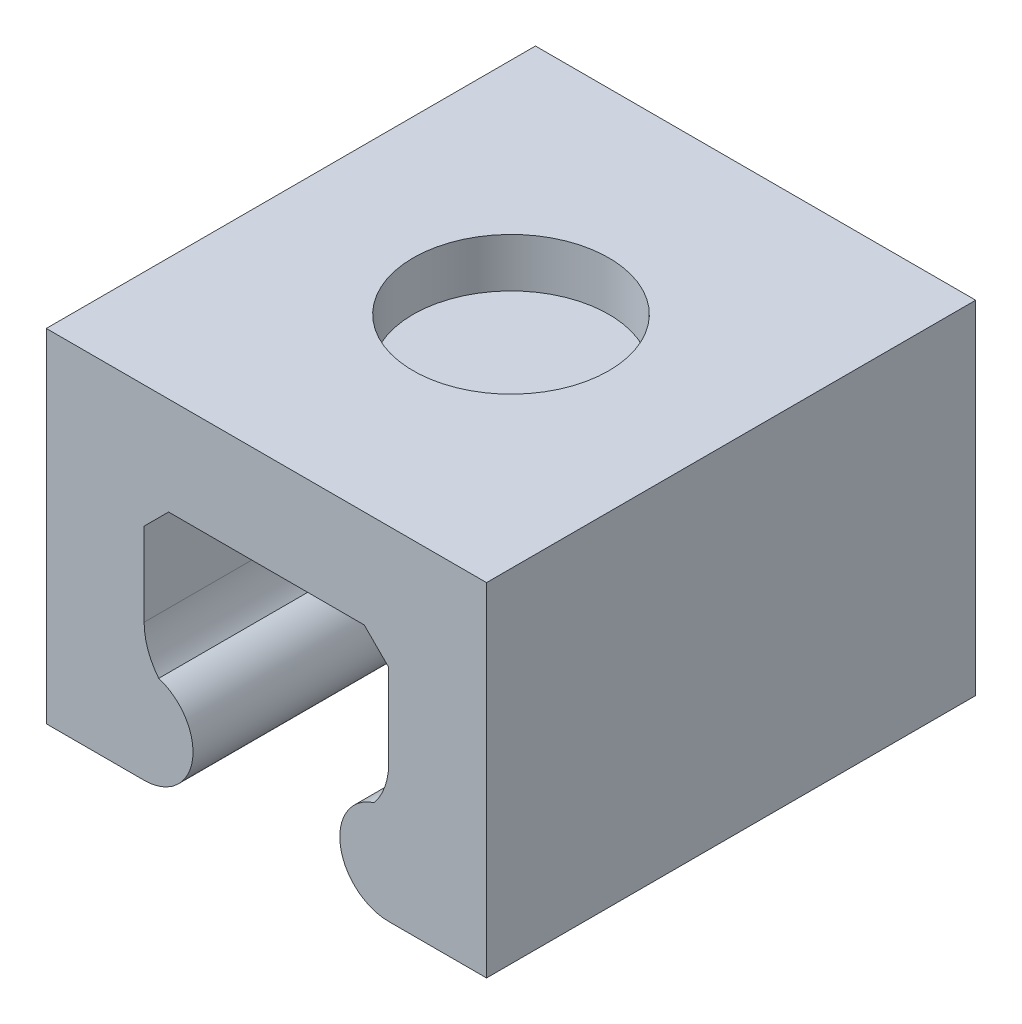
from build123d import *

# Parameters (mm, degrees)
BOSS_EXTRUDE1_DEPTH = 10
SKETCH2_R           = 2
CUT_EXTRUDE1_DEPTH  = 1


with BuildPart() as part:
    # Sketch1 → Boss-Extrude1 (new body)
    with BuildSketch(Plane.XY):
        with BuildLine():
            Line((2.5, 1.798202453), (2.5, 3.5))
            Line((2.5, 3.5), (2, 4))
            Line((2, 4), (-2, 4))
            Line((-2, 4), (-2.5, 3.5))
            Line((-2.5, 3.5), (-2.5, 1.798202453))
            ThreePointArc((-2.5, 1.798202453), (-2.423157727, 1.350663613), (-2.2014329, 0.954388646))
            ThreePointArc((-2.2014329, 0.954388646), (-1.511468603, -0.151015487), (-2.5, -1))
            Line((-2.5, -1), (-4.5, -1))
            Line((-4.5, -1), (-4.5, 6))
            Line((-4.5, 6), (4.5, 6))
            Line((4.5, 6), (4.5, -1))
            Line((4.5, -1), (2.5, -1))
            ThreePointArc((2.5, -1), (1.511468603, -0.151015487), (2.2014329, 0.954388646))
            ThreePointArc((2.2014329, 0.954388646), (2.423157727, 1.350663613), (2.5, 1.798202453))
        make_face()
    extrude(amount=BOSS_EXTRUDE1_DEPTH)

    # Sketch2 → Cut-Extrude1 (cut)
    with BuildSketch(Plane(origin=(0, 6, 0), x_dir=(1, 0, 0), z_dir=(0, 1, 0))):
        with Locations(Location((0, -5, 0), (0, 0, 180))):
            Circle(SKETCH2_R)
    extrude(amount=-CUT_EXTRUDE1_DEPTH, mode=Mode.SUBTRACT)


solid = part.part
